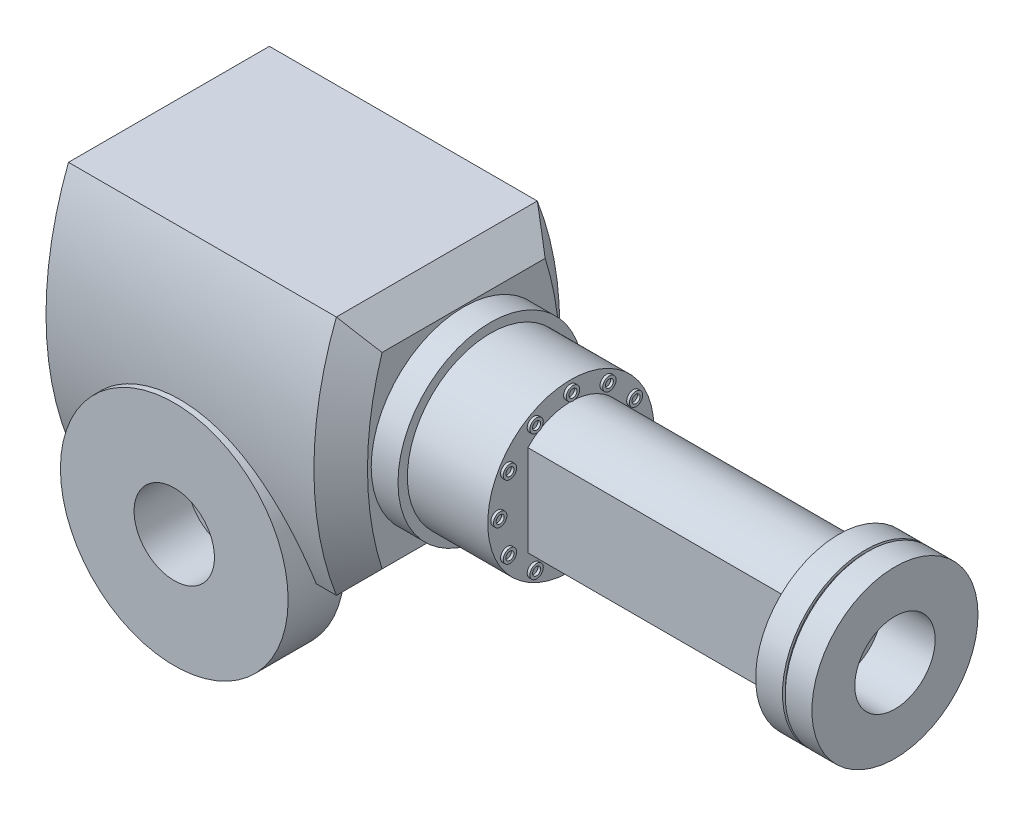
from build123d import *

# Parameters (mm, degrees)
BOSS_EXTRUDE1_DEPTH  = 100
BOSS_EXTRUDE2_DEPTH  = 10
BOSS_EXTRUDE2_DRAFT  = 45
SKETCH4_R            = 34.5
BOSS_EXTRUDE3_DEPTH  = 10
SKETCH5_R            = 31
BOSS_EXTRUDE4_DEPTH  = 30
SKETCH6_R            = 2.5
SKETCH6_R_2          = 1.5
BOSS_EXTRUDE5_DEPTH  = 1
CIRPATTERN1_COUNT    = 12
BOSS_EXTRUDE6_DEPTH  = 100
SKETCH8_R            = 31
BOSS_EXTRUDE7_DEPTH  = 10
SKETCH9_R            = 30
BOSS_EXTRUDE8_DEPTH  = 1
SKETCH10_R           = 31
BOSS_EXTRUDE9_DEPTH  = 10
SKETCH11_R           = 42.5
BOSS_EXTRUDE10_DEPTH = 10.5
BOSS_EXTRUDE11_DEPTH = 35
BOSS_EXTRUDE12_DEPTH = 40
CUT_EXTRUDE1_DEPTH   = 40
SKETCH15_R           = 15
CUT_EXTRUDE2_DEPTH   = 20
SKETCH16_R           = 15
CUT_EXTRUDE3_DEPTH   = 20


with BuildPart() as part:
    # Sketch1 → Boss-Extrude1 (new body)
    with BuildSketch(Plane(origin=(0, 0, 0), x_dir=(0, 0, -1), z_dir=(1, 0, 0))):
        with BuildLine():
            Line((-37.5, 45), (37.5, 45))
            ThreePointArc((37.5, 45), (45.880962103, 0), (37.5, -45))
            Line((37.5, -45), (-37.5, -45))
            ThreePointArc((-37.5, -45), (-45.880962103, 0), (-37.5, 45))
        make_face()
    extrude(amount=BOSS_EXTRUDE1_DEPTH)


with BuildPart() as boss_extrude2_tool:
    # Sketch2 → Boss-Extrude2 (with draft: the straight prism first)
    with BuildSketch(Plane(origin=(100, 0, 0), x_dir=(0, 0, -1), z_dir=(1, 0, 0))):
        with BuildLine():
            Line((37.5, 45), (-37.5, 45))
            ThreePointArc((-37.5, 45), (-45.880962103, 0), (-37.5, -45))
            Line((-37.5, -45), (37.5, -45))
            ThreePointArc((37.5, -45), (45.880962103, 0), (37.5, 45))
        make_face()
    extrude(amount=BOSS_EXTRUDE2_DEPTH)
    # Boss-Extrude2: the draft: its side faces are tilted about the plane it starts from
    boss_extrude2_sides = [boss_extrude2_tool.faces().sort_by_distance(p)[0] for p in [
        (105, -45, 0),
        (105, 0, -45.880962103),
        (105, 45, 0),
        (105, 0, 45.880962103),
    ]]
    draft(boss_extrude2_sides, Plane(origin=(100, 0, 0), x_dir=(0, 0, -1), z_dir=(1, 0, 0)), BOSS_EXTRUDE2_DRAFT)


with BuildPart() as part_1:
    add(part.part)

    # Boss-Extrude2: add boss_extrude2_tool
    add(boss_extrude2_tool.part)

    # Sketch4 → Boss-Extrude3 (add)
    with BuildSketch(Plane(origin=(110, 0, 0), x_dir=(0, 0, -1), z_dir=(1, 0, 0))):
        Circle(SKETCH4_R)
    extrude(amount=BOSS_EXTRUDE3_DEPTH)

    # Sketch5 → Boss-Extrude4 (add)
    with BuildSketch(Plane(origin=(120, 0, 0), x_dir=(0, 0, -1), z_dir=(1, 0, 0))):
        Circle(SKETCH5_R)
    extrude(amount=BOSS_EXTRUDE4_DEPTH)

    # Sketch6 → Boss-Extrude5 (add)
    with BuildSketch(Plane(origin=(150, 0, 0), x_dir=(0, 0, -1), z_dir=(1, 0, 0))):
        with Locations((27, 0)):
            Circle(SKETCH6_R)
        with Locations((27, 0)):
            Circle(SKETCH6_R_2, mode=Mode.SUBTRACT)
    boss_extrude5 = extrude(amount=BOSS_EXTRUDE5_DEPTH)

    # CirPattern1: Boss-Extrude5 ×12 about axis
    cirpattern1_axis = Axis((0, 0, 0.17674784), (1, 0, 0))
    for i in range(1, CIRPATTERN1_COUNT):
        add(boss_extrude5.rotate(cirpattern1_axis, i * 360 / CIRPATTERN1_COUNT))

    # Sketch7 → Boss-Extrude6 (add)
    with BuildSketch(Plane(origin=(150, 0, 0), x_dir=(0, 0, -1), z_dir=(1, 0, 0))):
        with BuildLine():
            Line((16, 17), (16, -17))
            ThreePointArc((16, -17), (0, -23.900331129), (-16, -17))
            Line((-16, -17), (-16, 17))
            ThreePointArc((-16, 17), (0, 23.900331129), (16, 17))
        make_face()
    extrude(amount=BOSS_EXTRUDE6_DEPTH)

    # Sketch8 → Boss-Extrude7 (add)
    with BuildSketch(Plane(origin=(250, 0, 0), x_dir=(0, 0, -1), z_dir=(1, 0, 0))):
        Circle(SKETCH8_R)
    extrude(amount=BOSS_EXTRUDE7_DEPTH)

    # Sketch9 → Boss-Extrude8 (add)
    with BuildSketch(Plane(origin=(260, 0, 0), x_dir=(0, 0, -1), z_dir=(1, 0, 0))):
        Circle(SKETCH9_R)
    extrude(amount=BOSS_EXTRUDE8_DEPTH)

    # Sketch10 → Boss-Extrude9 (add)
    with BuildSketch(Plane(origin=(261, 0, 0), x_dir=(0, 0, -1), z_dir=(1, 0, 0))):
        Circle(SKETCH10_R)
    extrude(amount=BOSS_EXTRUDE9_DEPTH)

    # Sketch11 → Boss-Extrude10 (add, symmetric)
    with BuildSketch(Plane.XY.offset(37.5)):
        with Locations((50, -45)):
            Circle(SKETCH11_R)
    extrude(amount=BOSS_EXTRUDE10_DEPTH, both=True)

    # Sketch12 → Boss-Extrude11 (add)
    with BuildSketch(Plane(origin=(0, 0, 27), x_dir=(-1, 0, 0), z_dir=(0, 0, -1))):
        with BuildLine():
            Line((-68.570979575, -45), (-28.570979575, -45))
            Line((-28.570979575, -45), (-28.570979575, -75))
            ThreePointArc((-28.570979575, -75), (-48.570979575, -82.639320225), (-68.570979575, -75))
            Line((-68.570979575, -75), (-68.570979575, -45))
        make_face()
    extrude(amount=BOSS_EXTRUDE11_DEPTH)

    # Sketch13 → Boss-Extrude12 (add)
    with BuildSketch(Plane(origin=(68.570979575, 0, 0), x_dir=(0, 0, -1), z_dir=(1, 0, 0))):
        with BuildLine():
            Line((8, -45), (8, -87))
            ThreePointArc((8, -87), (25.421855105, -68.929675658), (33, -45))
            Line((33, -45), (8, -45))
        make_face()
    extrude(amount=-BOSS_EXTRUDE12_DEPTH)

    # Sketch14 → Cut-Extrude1 (cut)
    with BuildSketch(Plane.XY.offset(-8)):
        with BuildLine():
            Line((28.570979575, -75), (28.570979575, -87))
            Line((28.570979575, -87), (68.570979575, -87))
            Line((68.570979575, -87), (68.570979575, -75))
            ThreePointArc((68.570979575, -75), (48.570979575, -82.639320225), (28.570979575, -75))
        make_face()
    extrude(amount=-CUT_EXTRUDE1_DEPTH, mode=Mode.SUBTRACT)

    # Sketch15 → Cut-Extrude2 (cut)
    with BuildSketch(Plane(origin=(271, 0, 0), x_dir=(0, 0, -1), z_dir=(1, 0, 0))):
        Circle(SKETCH15_R)
    extrude(amount=-CUT_EXTRUDE2_DEPTH, mode=Mode.SUBTRACT)

    # Sketch16 → Cut-Extrude3 (cut)
    with BuildSketch(Plane.XY.offset(48)):
        with Locations((50, -45)):
            Circle(SKETCH16_R)
    extrude(amount=-CUT_EXTRUDE3_DEPTH, mode=Mode.SUBTRACT)


solid = part_1.part
